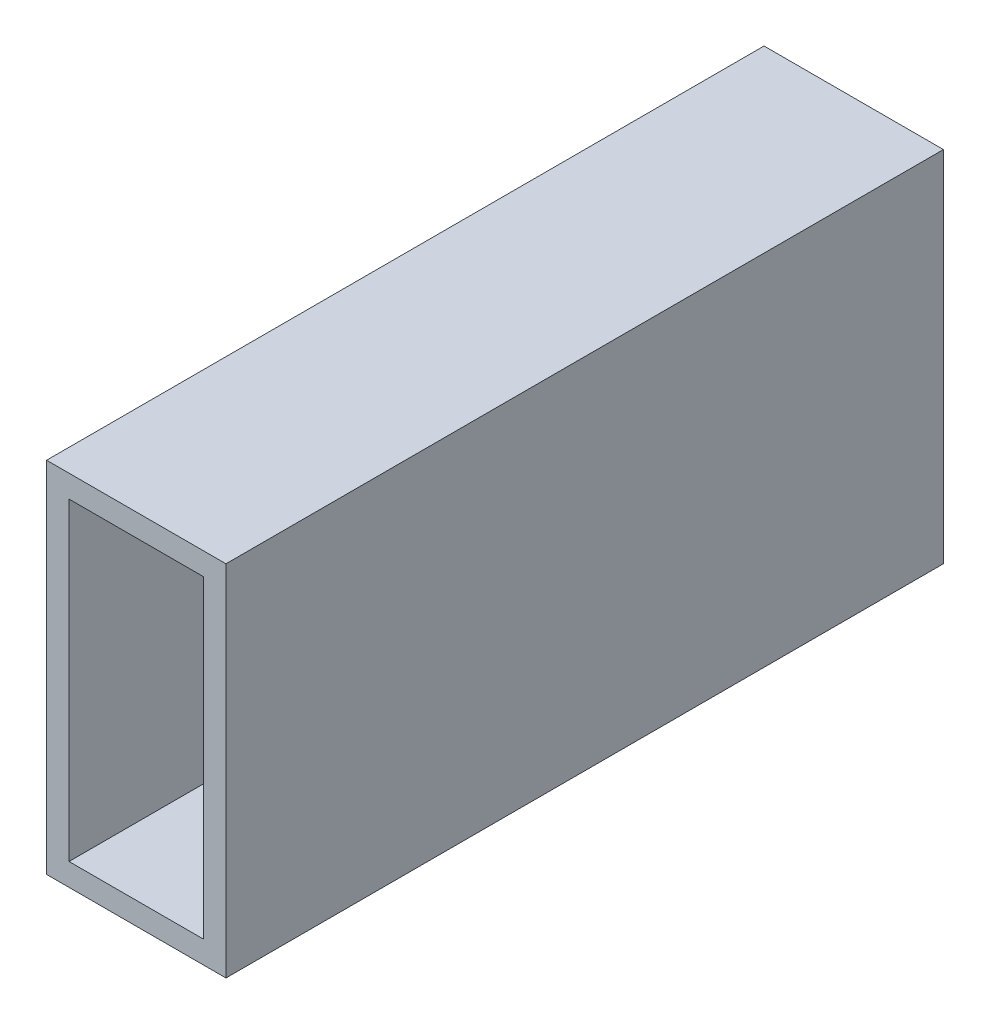
from build123d import *

# Parameters (mm, degrees)
SKETCH1_W           = 25.4
SKETCH1_H           = 50.8
SKETCH1_W_2         = 19.05
SKETCH1_H_2         = 44.45
BOSS_EXTRUDE1_DEPTH = 50.8


with BuildPart() as part:
    # Sketch1 → Boss-Extrude1 (new, symmetric)
    with BuildSketch(Plane.XY):
        Rectangle(SKETCH1_W, SKETCH1_H)
        Rectangle(SKETCH1_W_2, SKETCH1_H_2, mode=Mode.SUBTRACT)
    extrude(amount=BOSS_EXTRUDE1_DEPTH, both=True)


solid = part.part
